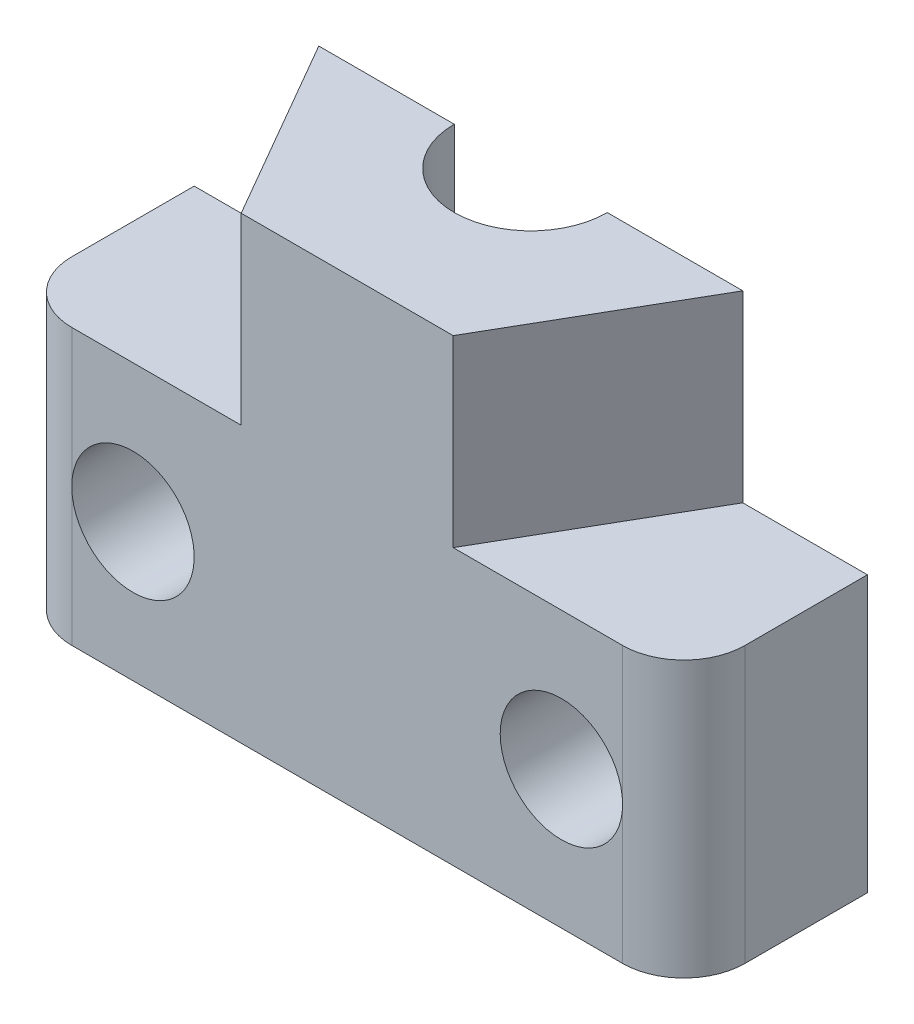
from build123d import *

# Parameters (mm, degrees)
SKETCH_1_W           = 22
SKETCH_1_H           = 12
EXTRUDE_1_DEPTH      = 9
FILLET_1_R           = 2
SKETCH_2_R           = 4
CUT_EXTRUDE_1_DEPTH  = 8
SKETCH_3_R           = 5
CUT_EXTRUDE_2_DEPTH  = 1
EXTRUDE_2_DEPTH      = 6
CUT_EXTRUDE_5_DEPTH  = 3
SKETCH_8_R           = 2.5
CUT_EXTRUDE_6_DEPTH  = 6
SKETCH_11_R          = 2
CUT_EXTRUDE_9_DEPTH  = 23.135943621
SKETCH_12_W          = 27.17111841
SKETCH_12_H          = 33.234136994
CUT_EXTRUDE_10_DEPTH = 10


with BuildPart() as part:
    # Эскиз1 → Бобышка-Вытянуть1 (new body)
    with BuildSketch(Plane(origin=(0, 0, 0), x_dir=(1, 0, 0), z_dir=(0, 1, 0))):
        Rectangle(SKETCH_1_W, SKETCH_1_H)
    extrude(amount=EXTRUDE_1_DEPTH)

    # Скругление1
    fillet_1_edges = [part.edges().sort_by_distance(p)[0] for p in [
        (11, 4.5, 6),
        (-11, 4.5, 6),
        (-11, 4.5, -6),
        (11, 4.5, -6),
    ]]
    fillet(fillet_1_edges, radius=FILLET_1_R)

    # Эскиз2 → Вырез-Вытянуть1 (cut)
    with BuildSketch(Plane(origin=(0, 0, 0), x_dir=(1, 0, 0), z_dir=(0, 1, 0))):
        with Locations(Location((0, 0, 0), (0, 0, 270))):
            Circle(SKETCH_2_R)
    extrude(amount=CUT_EXTRUDE_1_DEPTH, mode=Mode.SUBTRACT)

    # Эскиз3 → Вырез-Вытянуть2 (cut)
    with BuildSketch(Plane.XZ.offset(-8)):
        with Locations(Location((0, 0, 0), (0, 0, 270))):
            Circle(SKETCH_3_R)
    extrude(amount=-CUT_EXTRUDE_2_DEPTH, mode=Mode.SUBTRACT)

    # Эскиз6 → Бобышка-Вытянуть2 (add)
    with BuildSketch(Plane(origin=(0, 9, 0), x_dir=(1, 0, 0), z_dir=(0, 1, 0))):
        Polygon((6.92820323, 0), (3.464101615, 6), (-3.464101615, 6), (-6.92820323, 0), (-3.464101615, -6), (3.464101615, -6), align=None)
    extrude(amount=EXTRUDE_2_DEPTH)

    # Эскиз7 → Вырез-Вытянуть5 (cut)
    with BuildSketch(Plane(origin=(0, 9, 0), x_dir=(1, 0, 0), z_dir=(0, 1, 0))):
        Polygon((5.773502692, 0), (2.886751346, 5), (-2.886751346, 5), (-5.773502692, 0), (-2.886751346, -5), (2.886751346, -5), align=None)
    extrude(amount=CUT_EXTRUDE_5_DEPTH, mode=Mode.SUBTRACT)

    # Эскиз8 → Вырез-Вытянуть6 (cut)
    with BuildSketch(Plane(origin=(0, 9, 0), x_dir=(1, 0, 0), z_dir=(0, 1, 0))):
        with Locations(Location((0, 0, 0), (0, 0, 90))):
            Circle(SKETCH_8_R)
    extrude(amount=CUT_EXTRUDE_6_DEPTH, mode=Mode.SUBTRACT)

    # Эскиз11 → Вырез-Вытянуть9 (cut, through all)
    with BuildSketch(Plane(origin=(0, 0, -6), x_dir=(-1, 0, 0), z_dir=(0, 0, -1))):
        with Locations((7, 4.5)):
            Circle(SKETCH_11_R)
    cut_extrude_9 = extrude(amount=-CUT_EXTRUDE_9_DEPTH, mode=Mode.SUBTRACT)

    # Зеркальное отражение6: Вырез-Вытянуть9 across plane
    add(cut_extrude_9.mirror(Plane(origin=(0, 0, 0), x_dir=(0, 0, 1), z_dir=(1, 0, 0))), mode=Mode.SUBTRACT)

    # Эскиз12 → Вырез-Вытянуть10 (cut)
    with BuildSketch(Plane.XY):
        Rectangle(SKETCH_12_W, SKETCH_12_H)
    extrude(amount=-CUT_EXTRUDE_10_DEPTH, mode=Mode.SUBTRACT)


solid = part.part
